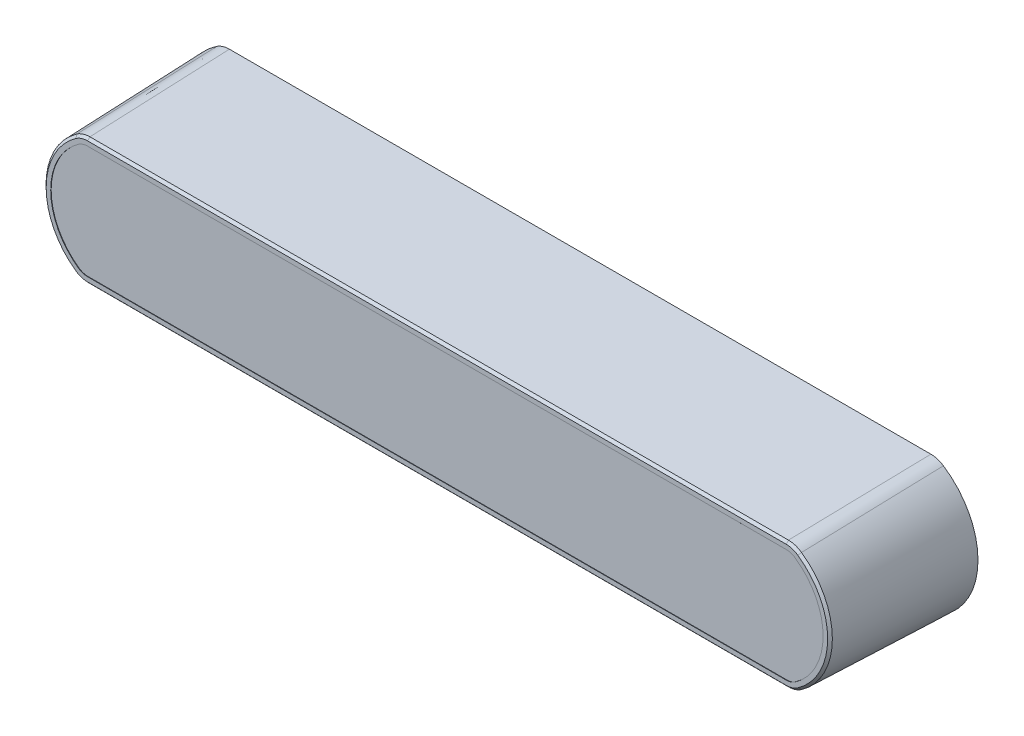
from build123d import *
from OCP.BRepFilletAPI import BRepFilletAPI_MakeChamfer

# Parameters (mm, degrees)
BOSS_EXTRUDE1_DEPTH = 31.5
BOSS_EXTRUDE1_TAPER = 1.9
FILLET1_R           = 5
CHAMFER2_SIZE       = 0.5
CHAMFER2_SIZE2      = 0.517440306
CHAMFER2_SIZE2_2    = 0.518340503
SKETCH2_R           = 2
BOSS_EXTRUDE2_DEPTH = 10
CUT_EXTRUDE2_DEPTH  = 0.1
CUT_EXTRUDE3_DEPTH  = 0.1
SKETCH5_R           = 2.5
CUT_EXTRUDE4_DEPTH  = 10


with BuildPart() as part:
    # Sketch1 → Boss-Extrude1 (new body)
    with BuildSketch(Plane.XY):
        with BuildLine():
            ThreePointArc((-78.5, 15), (-87.5, 0), (-78.5, -15))
            Line((-78.5, -15), (78.5, -15))
            ThreePointArc((78.5, -15), (87.5, 0), (78.5, 15))
            Line((78.5, 15), (-78.5, 15))
        make_face()
    extrude(amount=BOSS_EXTRUDE1_DEPTH, taper=BOSS_EXTRUDE1_TAPER)

    # Fillet1
    fillet1_edges = [part.edges().sort_by_distance(p)[0] for p in [
        (78.368295463, -14.477518375, 15.750009445),
        (-78.368295463, -14.477518375, 15.750009445),
        (-78.368295463, 14.477518375, 15.750009445),
        (78.368295463, 14.477518375, 15.750009445),
    ]]
    fillet(fillet1_edges, radius=FILLET1_R)

    # Chamfer2: one chamfer whose edges measure the first distance from different faces: ONE call of the kernel's chamfer builder (chamfer() names one face for all edges)
    chamfer2_edges_1 = [part.edges().sort_by_distance(p)[0] for p in [
        (86.455037377, 0, 31.5),
    ]]
    chamfer2_side_1 = [part.faces().sort_by_distance(p)[0] for p in [
        (86.977518688, 0, 15.75),
    ]]
    chamfer2_edges_2 = [part.edges().sort_by_distance(p)[0] for p in [
        (78.320821147, 13.721567571, 31.5),
    ]]
    chamfer2_side_2 = [part.faces().sort_by_distance(p)[0] for p in [
        (78.449460209, 14.254751063, 15.755250867),
    ]]
    chamfer2_edges_3 = [part.edges().sort_by_distance(p)[0] for p in [
        (78.320821147, -13.721567571, 31.5),
    ]]
    chamfer2_side_3 = [part.faces().sort_by_distance(p)[0] for p in [
        (78.449460207, -14.254751054, 15.755251143),
    ]]
    chamfer2_edges_4 = [part.edges().sort_by_distance(p)[0] for p in [
        (0, 13.955037377, 31.5),
    ]]
    chamfer2_side_4 = [part.faces().sort_by_distance(p)[0] for p in [
        (0, 14.477883921, 15.738990209),
    ]]
    chamfer2_edges_5 = [part.edges().sort_by_distance(p)[0] for p in [
        (0, -13.955037377, 31.5),
    ]]
    chamfer2_side_5 = [part.faces().sort_by_distance(p)[0] for p in [
        (0, -14.477883921, 15.738990209),
    ]]
    chamfer2_edges_6 = [part.edges().sort_by_distance(p)[0] for p in [
        (-78.320821147, 13.721567571, 31.5),
    ]]
    chamfer2_side_6 = [part.faces().sort_by_distance(p)[0] for p in [
        (-78.449460209, 14.254751063, 15.755250867),
    ]]
    chamfer2_edges_7 = [part.edges().sort_by_distance(p)[0] for p in [
        (-78.320821147, -13.721567571, 31.5),
    ]]
    chamfer2_side_7 = [part.faces().sort_by_distance(p)[0] for p in [
        (-78.449460209, -14.254751063, 15.755250867),
    ]]
    chamfer2_edges_8 = [part.edges().sort_by_distance(p)[0] for p in [
        (-86.455037377, 0, 31.5),
    ]]
    chamfer2_side_8 = [part.faces().sort_by_distance(p)[0] for p in [
        (-86.977518688, 0, 15.75),
    ]]
    chamfer2 = BRepFilletAPI_MakeChamfer(part.part.solid().wrapped)
    for e in chamfer2_edges_1:
        chamfer2.Add(CHAMFER2_SIZE, CHAMFER2_SIZE2, e.wrapped, chamfer2_side_1[0].wrapped)  # the first distance lies on this face
    for e in chamfer2_edges_2:
        chamfer2.Add(CHAMFER2_SIZE, CHAMFER2_SIZE2_2, e.wrapped, chamfer2_side_2[0].wrapped)  # the first distance lies on this face
    for e in chamfer2_edges_3:
        chamfer2.Add(CHAMFER2_SIZE, CHAMFER2_SIZE2_2, e.wrapped, chamfer2_side_3[0].wrapped)  # the first distance lies on this face
    for e in chamfer2_edges_4:
        chamfer2.Add(CHAMFER2_SIZE, CHAMFER2_SIZE2, e.wrapped, chamfer2_side_4[0].wrapped)  # the first distance lies on this face
    for e in chamfer2_edges_5:
        chamfer2.Add(CHAMFER2_SIZE, CHAMFER2_SIZE2, e.wrapped, chamfer2_side_5[0].wrapped)  # the first distance lies on this face
    for e in chamfer2_edges_6:
        chamfer2.Add(CHAMFER2_SIZE, CHAMFER2_SIZE2_2, e.wrapped, chamfer2_side_6[0].wrapped)  # the first distance lies on this face
    for e in chamfer2_edges_7:
        chamfer2.Add(CHAMFER2_SIZE, CHAMFER2_SIZE2_2, e.wrapped, chamfer2_side_7[0].wrapped)  # the first distance lies on this face
    for e in chamfer2_edges_8:
        chamfer2.Add(CHAMFER2_SIZE, CHAMFER2_SIZE2, e.wrapped, chamfer2_side_8[0].wrapped)  # the first distance lies on this face
    add(Compound.cast(chamfer2.Shape()), mode=Mode.REPLACE)

    # Sketch2 → Boss-Extrude2 (add)
    with BuildSketch(Plane(origin=(0, 0, 0), x_dir=(1, 0, 0), z_dir=(0, 0, -1))):
        with Locations(Location((0, 9, 0), (0, 0, 270))):
            Circle(SKETCH2_R)
    extrude(amount=BOSS_EXTRUDE2_DEPTH)

    # Sketch4 → Cut-Extrude2 (cut)
    with BuildSketch(Plane(origin=(0, 0, 0), x_dir=(1, 0, 0), z_dir=(0, 0, -1))):
        with BuildLine():
            Line((77.134085725, 14), (-77.13407836, 14))
            ThreePointArc((-77.13407836, 14), (-78.28785125, 13.829871561), (-79.343405855, 13.333948136))
            ThreePointArc((-79.343405855, 13.333948136), (-86.5, 0), (-79.343405855, -13.333948136))
            ThreePointArc((-79.343405855, -13.333948136), (-78.287854776, -13.829870498), (-77.134085725, -14))
            Line((-77.134085725, -14), (77.13407836, -14))
            ThreePointArc((77.13407836, -14), (78.28785125, -13.829871561), (79.343405855, -13.333948136))
            ThreePointArc((79.343405855, -13.333948136), (86.5, -3.683e-06), (79.343411993, 13.333944065))
            ThreePointArc((79.343411993, 13.333944065), (78.287858302, 13.829869435), (77.134085725, 14))
        make_face()
    extrude(amount=-CUT_EXTRUDE2_DEPTH, mode=Mode.SUBTRACT)


with BuildPart() as cut_extrude2_piece_1:
    # of the separate pieces the step leaves, piece 1, a body of its own (cut_extrude2_pieces)
    add(part.part.solids().sort_by_distance((76.816448619, 13.971614966, 31.000274892))[0])

    # Sketch3 → Cut-Extrude3 (cut)
    with BuildSketch(Plane.XY.offset(31.5)):
        with BuildLine():
            Line((-76.816443267, -12.437597071), (76.816344015, -12.437597076))
            add(Edge.make_bspline(
                [(76.816344015, -12.437597076), (76.994001702, -12.437579443), (77.169987293, -12.423992087), (77.51868719, -12.370269587), (77.692266942, -12.329673515), (78.198608665, -12.169572794), (78.519150863, -12.010927613), (78.809753873, -11.806447381)],
                knots=[0, 0, 0, 0, 0.25, 0.25, 0.5, 0.5, 1, 1, 1, 1], degree=3))
            ThreePointArc((78.809753873, -11.806447381), (84.937597071, -4.9626e-05), (78.80983504, 11.806390259))
            add(Edge.make_bspline(
                [(78.80983504, 11.806390259), (78.664544058, 11.908629119), (78.512810207, 11.998808845), (78.196737684, 12.155575821), (78.031425993, 12.222284265), (77.525213328, 12.382792579), (77.171777297, 12.437551746), (76.816443267, 12.437597071)],
                knots=[0, 0, 0, 0, 0.25, 0.25, 0.5, 0.5, 1, 1, 1, 1], degree=3))
            Line((76.816443267, 12.437597071), (-76.816344015, 12.437597076))
            add(Edge.make_bspline(
                [(-76.816344015, 12.437597076), (-76.994001702, 12.437579443), (-77.169987293, 12.423992087), (-77.51868719, 12.370269587), (-77.692266942, 12.329673515), (-78.198608665, 12.169572794), (-78.519150863, 12.010927613), (-78.809753873, 11.806447381)],
                knots=[0, 0, 0, 0, 0.25, 0.25, 0.5, 0.5, 1, 1, 1, 1], degree=3))
            ThreePointArc((-78.809753873, 11.806447381), (-84.937597071, 4.9626e-05), (-78.80983504, -11.806390259))
            add(Edge.make_bspline(
                [(-78.80983504, -11.806390259), (-78.664544058, -11.908629119), (-78.512810207, -11.998808845), (-78.196737684, -12.155575821), (-78.031425993, -12.222284265), (-77.525213328, -12.382792579), (-77.171777297, -12.437551746), (-76.816443267, -12.437597071)],
                knots=[0, 0, 0, 0, 0.25, 0.25, 0.5, 0.5, 1, 1, 1, 1], degree=3))
        make_face()
    extrude(amount=-CUT_EXTRUDE3_DEPTH, mode=Mode.SUBTRACT)

    # Sketch5 → Cut-Extrude4 (cut)
    with BuildSketch(Plane(origin=(0, -15, 0), x_dir=(1, 0, 0), z_dir=(0, 1, 0))):
        with Locations(Location((0, -16.8, 0), (0, 0, 90))):
            Circle(SKETCH5_R)
    extrude(amount=CUT_EXTRUDE4_DEPTH, mode=Mode.SUBTRACT)


with BuildPart() as cut_extrude2_piece_2:
    # of the separate pieces the step leaves, piece 2, a body of its own (cut_extrude2_pieces)
    add(part.part.solids().sort_by_distance((0, -7, 0))[0])


solid = Compound([cut_extrude2_piece_1.part, cut_extrude2_piece_2.part])
